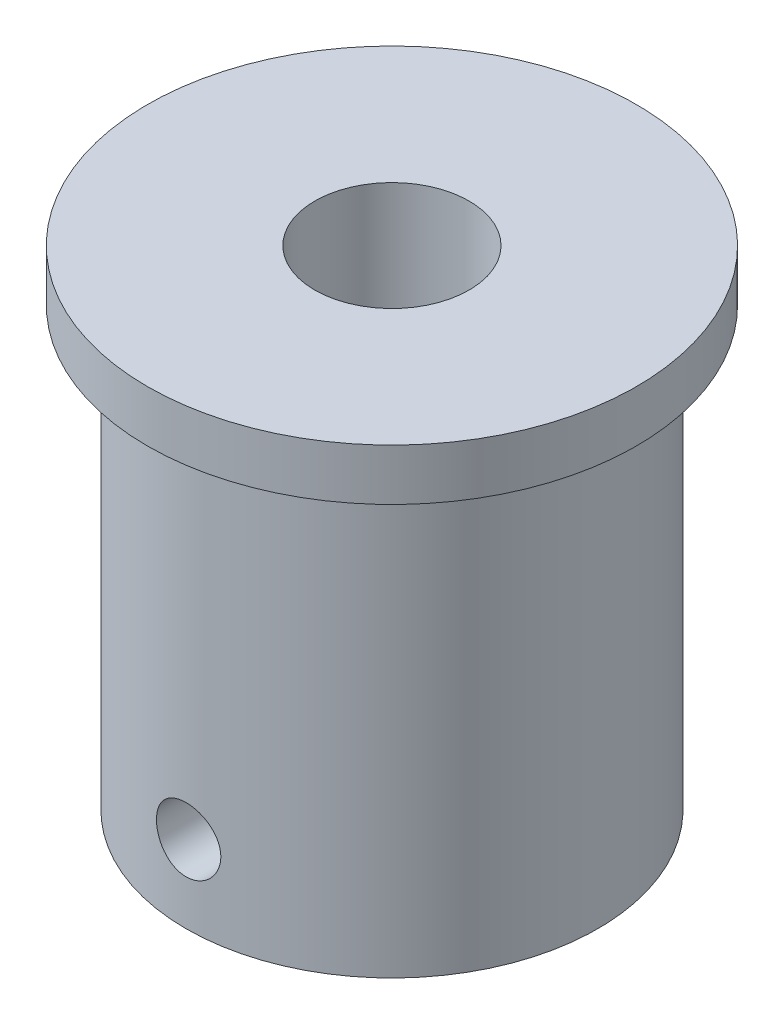
from build123d import *

# Parameters (mm, degrees)
SKETCH1_R           = 4
BOSS_EXTRUDE1_DEPTH = 8.5
SKETCH2_R           = 4.75
BOSS_EXTRUDE2_DEPTH = 1
SKETCH8_R           = 1.5
CUT_EXTRUDE2_DEPTH  = 12.635076278
M1_6_TAPPED_HOLE4_D = 1.25


with BuildPart() as part:
    # Sketch1 → Boss-Extrude1 (new body)
    with BuildSketch(Plane(origin=(0, 0, 0), x_dir=(1, 0, 0), z_dir=(0, 1, 0))):
        with Locations(Location((0, 0, 0), (0, 0, 270))):
            Circle(SKETCH1_R)
    extrude(amount=BOSS_EXTRUDE1_DEPTH)

    # Sketch2 → Boss-Extrude2 (add)
    with BuildSketch(Plane(origin=(0, 8.5, 0), x_dir=(1, 0, 0), z_dir=(0, 1, 0))):
        with Locations(Location((0, 0, 0), (0, 0, 270))):
            Circle(SKETCH2_R)
    extrude(amount=BOSS_EXTRUDE2_DEPTH)

    # Sketch8 → Cut-Extrude2 (cut, through all)
    with BuildSketch(Plane(origin=(0, 9.5, 0), x_dir=(1, 0, 0), z_dir=(0, 1, 0))):
        with Locations(Location((0, 0, 0), (0, 0, 270))):
            Circle(SKETCH8_R)
    extrude(amount=-CUT_EXTRUDE2_DEPTH, mode=Mode.SUBTRACT)

    # M1.6 Tapped Hole4 (through all)
    with Locations(Plane(origin=(0, 0, -5), x_dir=(1, 0, 0), z_dir=(0, 0, -1))):
        with Locations((0, -1.5)):
            Hole(M1_6_TAPPED_HOLE4_D / 2)


solid = part.part
